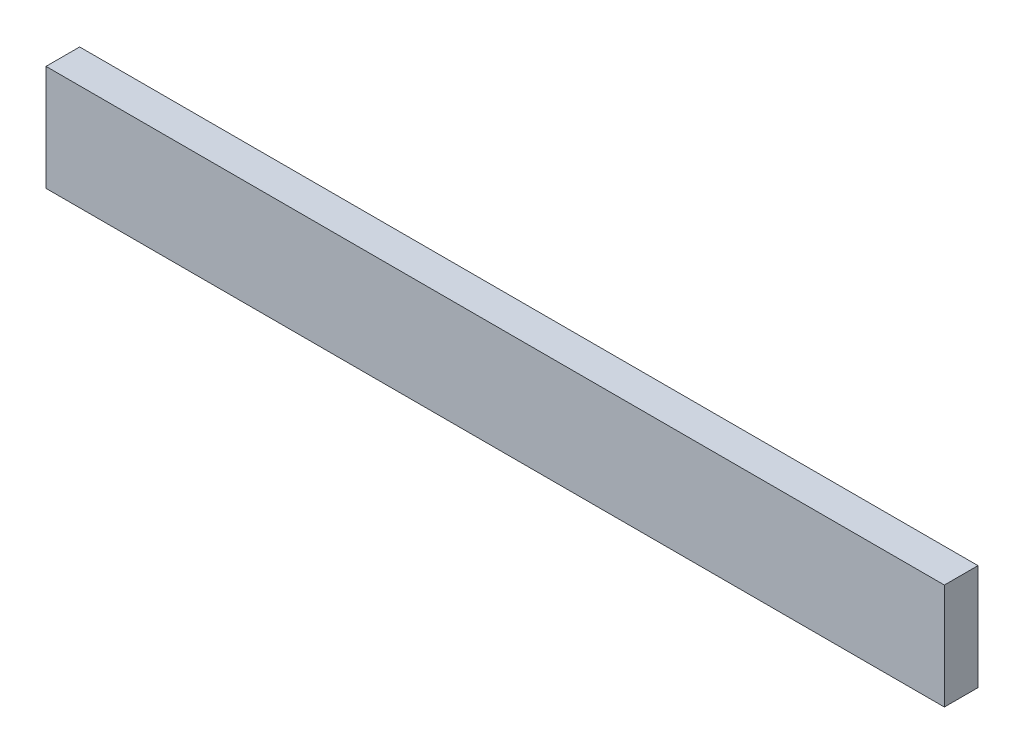
from build123d import *

# Parameters (mm, degrees)
ESBO_O1_W                = 46.75
ESBO_O1_H                = 5.5
RESSALTO_EXTRUS_O1_DEPTH = 1.75


with BuildPart() as part:
    # Esboço1 → Ressalto-extrusão1 (new body)
    with BuildSketch(Plane.XY):
        with Locations((-22.728205296, 17.664343023)):
            Rectangle(ESBO_O1_W, ESBO_O1_H)
    extrude(amount=RESSALTO_EXTRUS_O1_DEPTH)


solid = part.part
